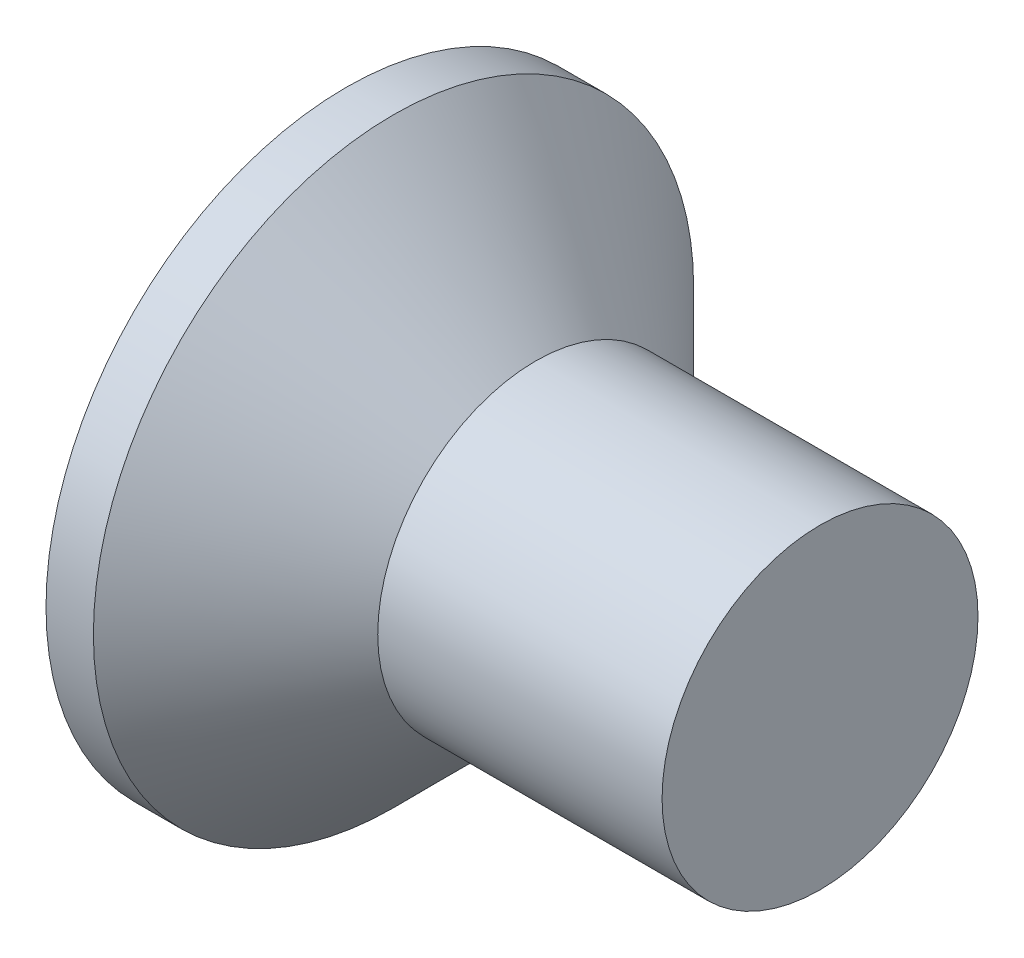
from build123d import *

# Parameters (mm, degrees)
CIRPATTERN1_COUNT = 2
CIRPATTERN1_ANGLE = 90


with BuildPart() as part:
    # BodySke → Base-Revolve (revolve)
    with BuildSketch(Plane.XY, mode=Mode.PRIVATE) as base_revolve_sk:
        Polygon((0, 0), (0, 1.9), (0.3, 1.9), (1.2, 1), (3, 1), (3, 0), align=None)
    revolve(base_revolve_sk.sketch.rotate(Axis((-6.35, 0, 0), (1, 0, 0)), 90), axis=Axis((-6.35, 0, 0), (1, 0, 0)))

    # Sketch3 → Cross section 0
    with BuildSketch(Plane.ZY):
        with BuildLine():
            Line((-0.265, 1.07), (0.265, 1.07))
            Line((0.265, 1.07), (0.265, -1.07))
            Line((0.265, -1.07), (-0.265, -1.07))
            Line((-0.265, -1.07), (-0.265, 1.07))
        make_face()
    # Sketch4 → Cross section 1
    with BuildSketch(Plane.ZY.offset(-1.54)):
        with BuildLine():
            Line((-0.1325, 0.1325), (0.1325, 0.1325))
            Line((0.1325, 0.1325), (0.1325, -0.1325))
            Line((0.1325, -0.1325), (-0.1325, -0.1325))
            Line((-0.1325, -0.1325), (-0.1325, 0.1325))
        make_face()
    cross = loft(mode=Mode.SUBTRACT)

    # CirPattern1: Cross ×2 about axis
    cirpattern1_axis = Axis((0, 0, 0), (1, 0, 0))
    for i in range(1, CIRPATTERN1_COUNT):
        add(cross.rotate(cirpattern1_axis, i * CIRPATTERN1_ANGLE / (CIRPATTERN1_COUNT - 1)), mode=Mode.SUBTRACT)


solid = part.part
